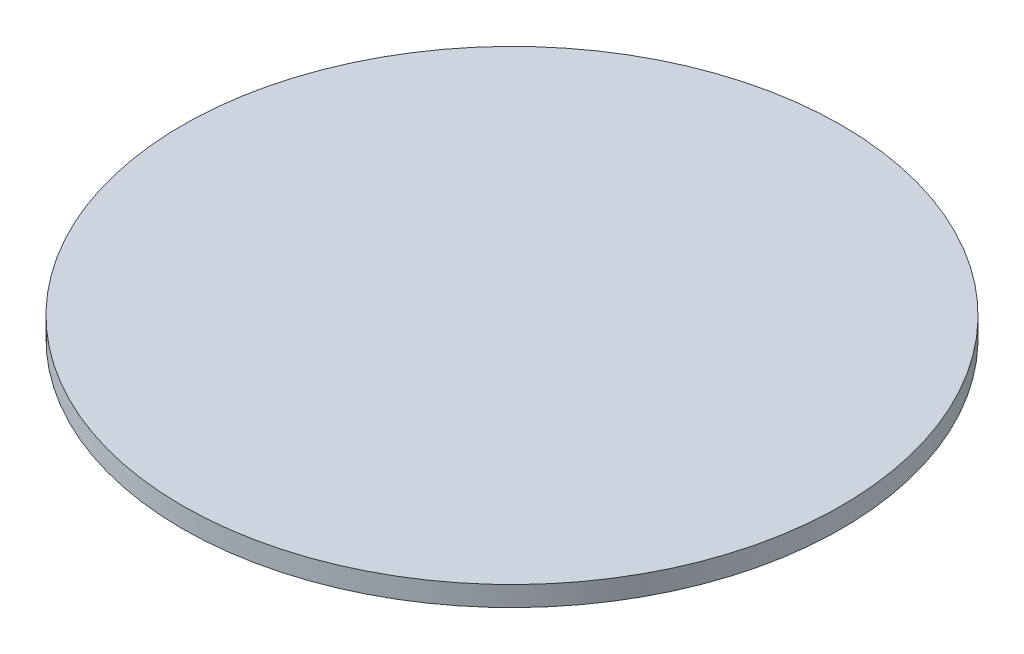
from build123d import *

# Parameters (mm, degrees)
SKETCH2_R           = 69.85
BOSS_EXTRUDE1_DEPTH = 4.233333333


with BuildPart() as part:
    # Sketch2 → Boss-Extrude1 (new body)
    with BuildSketch(Plane(origin=(0, 0, 0), x_dir=(1, 0, 0), z_dir=(0, 1, 0))):
        with Locations(Location((0, 0, 0), (0, 0, 270))):
            Circle(SKETCH2_R)
    extrude(amount=BOSS_EXTRUDE1_DEPTH)


solid = part.part
